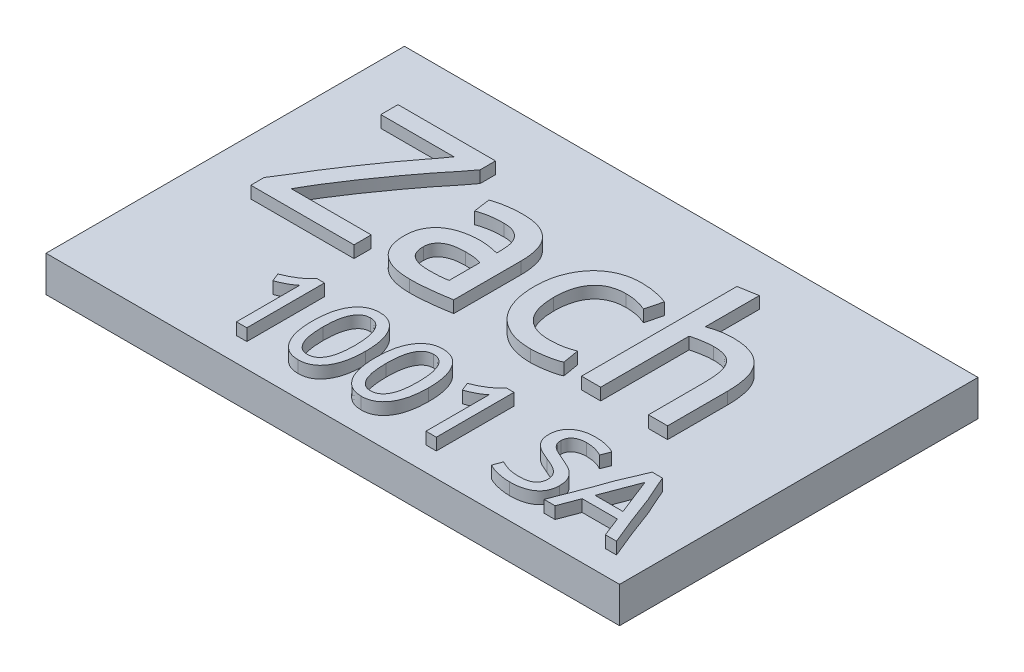
from build123d import *

# Parameters (mm, degrees)
SKETCH1_W           = 48
SKETCH1_H           = 30
BOSS_EXTRUDE1_DEPTH = 3
BOSS_EXTRUDE2_DEPTH = 1
BOSS_EXTRUDE3_DEPTH = 1
SKETCH4_W           = 46
SKETCH4_H           = 14
CUT_EXTRUDE1_DEPTH  = 1


with BuildPart() as part:
    # Sketch1 → Boss-Extrude1 (new body)
    with BuildSketch(Plane(origin=(0, 0, 0), x_dir=(1, 0, 0), z_dir=(0, 1, 0))):
        Rectangle(SKETCH1_W, SKETCH1_H)
    extrude(amount=BOSS_EXTRUDE1_DEPTH)

    # Sketch2 → Boss-Extrude2 (add)
    # profile 1 of 6: a face of its own
    with BuildSketch(Plane(origin=(0, 3, 0), x_dir=(1, 0, 0), z_dir=(0, 1, 0))):
        with BuildLine():
            add(Edge.make_bspline(
                [(20.8190625, -13), (20.761807352, -12.854173323), (20.650636551, -12.571025533), (20.48598857, -12.155157713), (20.327823205, -11.751782411), (20.222834076, -11.48601949), (20.170416667, -11.353333333)],
                knots=[0, 0, 0, 0, 1.062237098, 2.062517583, 3.032682611, 4, 4, 4, 4], degree=3))
            Line((20.170416667, -11.353333333), (17.2278125, -11.353333333))
            Line((17.2278125, -11.353333333), (16.60625, -13))
            Line((16.60625, -13), (15.68, -13))
            add(Edge.make_bspline(
                [(15.68, -13), (15.744821902, -12.833818932), (15.872240995, -12.507160193), (16.06273731, -12.027772572), (16.241862799, -11.564634011), (16.417870298, -11.119989175), (16.586201878, -10.687924801), (16.741576351, -10.264600062), (16.892947004, -9.851356741), (17.028411342, -9.443833001), (17.165283229, -9.046661754), (17.310557286, -8.662073666), (17.461536484, -8.289215602), (17.675399086, -7.810041385), (17.941578878, -7.21894363), (18.134037627, -6.73903085), (18.229895833, -6.5)],
                knots=[0, 0, 0, 0, 1.072638977, 2.108464584, 3.101975064, 4.058669342, 4.98415727, 5.890223607, 6.770302648, 7.630393209, 8.472516756, 9.296294923, 10.102279314, 10.891058867, 12.451525209, 14, 14, 14, 14], degree=3))
            Line((18.229895833, -6.5), (19.095208333, -6.5))
            add(Edge.make_bspline(
                [(19.095208333, -6.5), (19.196442907, -6.744035481), (19.397845932, -7.229536452), (19.674611509, -7.825573535), (19.895467203, -8.304015687), (20.054526587, -8.674142624), (20.204248223, -9.057069953), (20.346405395, -9.452230923), (20.49015853, -9.856553347), (20.643747325, -10.268664226), (20.805455931, -10.68925814), (20.979498189, -11.118901386), (21.160161008, -11.562838639), (21.348343181, -12.024629845), (21.545003917, -12.505684979), (21.678527564, -12.832977672), (21.746666667, -13)],
                knots=[0, 0, 0, 0, 1.580032327, 3.143424997, 3.929926182, 4.731809389, 5.552523687, 6.388666205, 7.243499056, 8.11910645, 9.019081739, 9.938542983, 10.891608821, 11.885790057, 12.921087233, 14, 14, 14, 14], degree=3))
            Line((21.746666667, -13), (20.8190625, -13))
        make_face()
        with BuildLine():
            add(Edge.make_bspline(
                [(19.863020833, -10.573333333), (19.76115474, -10.313726537), (19.559137918, -9.798884569), (19.256059293, -9.03411697), (18.962235431, -8.28183259), (18.766715196, -7.785509191), (18.67, -7.54)],
                knots=[0, 0, 0, 0, 1.02669444, 2.036099954, 3.028545676, 4, 4, 4, 4], degree=3))
            add(Edge.make_bspline(
                [(18.67, -7.54), (18.577162775, -7.786966003), (18.389368531, -8.286537098), (18.102851975, -9.04033945), (17.813146681, -9.804233136), (17.620830154, -10.316439453), (17.524375, -10.573333333)],
                knots=[0, 0, 0, 0, 0.976437122, 1.975169686, 2.984458995, 4, 4, 4, 4], degree=3))
            Line((17.524375, -10.573333333), (19.863020833, -10.573333333))
        make_face(mode=Mode.SUBTRACT)
    # profile 2 of 6: a face of its own
    with BuildSketch(Plane(origin=(0, 3, 0), x_dir=(1, 0, 0), z_dir=(0, 1, 0))):
        with BuildLine():
            add(Edge.make_bspline(
                [(12.9784375, -12.393333333), (13.034890788, -12.392641957), (13.144775376, -12.391296214), (13.303787709, -12.378407742), (13.452467748, -12.360828973), (13.589272929, -12.331587259), (13.715952999, -12.297183299), (13.831556415, -12.253711697), (13.936502897, -12.202908563), (14.029115933, -12.142046997), (14.112840376, -12.07652795), (14.18413179, -12.000255841), (14.24530268, -11.916880408), (14.293686564, -11.824610977), (14.334479377, -11.726303303), (14.360422604, -11.618482644), (14.377123193, -11.50327075), (14.379025759, -11.4238128), (14.38, -11.383125)],
                knots=[0, 0, 0, 0, 1.377492973, 2.681247697, 3.891940251, 5.028431159, 6.092277143, 7.092864452, 8.038832474, 8.931122951, 9.793110516, 10.626971684, 11.47095992, 12.308886602, 13.164018022, 14.061800404, 15.007511787, 16, 16, 16, 16], degree=3))
            add(Edge.make_bspline(
                [(14.38, -11.383125), (14.378248526, -11.332966636), (14.374870284, -11.236221197), (14.354425681, -11.096399296), (14.313900234, -10.969486637), (14.261092813, -10.85275502), (14.193202311, -10.746688112), (14.116136108, -10.647840403), (14.028563113, -10.555656857), (13.894216999, -10.443639184), (13.705362657, -10.315091342), (13.45099212, -10.185303397), (13.176042084, -10.062678665), (12.986243636, -9.982163236), (12.8890625, -9.9409375)],
                knots=[0, 0, 0, 0, 0.811365835, 1.5649622, 2.276000999, 2.95859887, 3.630934483, 4.306944628, 4.983230544, 5.682292857, 7.131827656, 8.666343326, 10.293091724, 12, 12, 12, 12], degree=3))
            add(Edge.make_bspline(
                [(12.8890625, -9.9409375), (12.776371075, -9.895617212), (12.553287138, -9.805901174), (12.281123213, -9.684204557), (12.074607748, -9.578150145), (11.931874953, -9.490865041), (11.79908957, -9.397592238), (11.675778846, -9.297741743), (11.566378226, -9.186876267), (11.465685139, -9.069401214), (11.381156441, -8.939070663), (11.305121612, -8.800751564), (11.244611606, -8.648765182), (11.203566488, -8.48156441), (11.177232941, -8.300074076), (11.17466016, -8.173847285), (11.173333333, -8.10875)],
                knots=[0, 0, 0, 0, 1.881476714, 3.724571196, 4.615906794, 5.475721414, 6.3137665, 7.128471691, 7.929438621, 8.723539643, 9.520590439, 10.330872839, 11.165761655, 12.045919756, 12.992247868, 14, 14, 14, 14], degree=3))
            add(Edge.make_bspline(
                [(11.173333333, -8.10875), (11.175296653, -8.040513417), (11.179120728, -7.907604914), (11.204736213, -7.713684568), (11.249268627, -7.530972405), (11.313036278, -7.36034556), (11.3936935, -7.201210227), (11.491906996, -7.053584871), (11.608980622, -6.917797268), (11.744017172, -6.794465042), (11.89351955, -6.683703394), (12.058266257, -6.588250847), (12.23564201, -6.507295521), (12.42687379, -6.440496407), (12.631398234, -6.389562728), (12.849699214, -6.353675915), (13.080814717, -6.329578615), (13.23972774, -6.327652326), (13.321041667, -6.326666667)],
                knots=[0, 0, 0, 0, 1.036936748, 2.019704159, 2.966376421, 3.888880766, 4.781625726, 5.672022014, 6.576782996, 7.499210823, 8.445883085, 9.398871932, 10.387273209, 11.404763735, 12.472884254, 13.585964168, 14.764766231, 16, 16, 16, 16], degree=3))
            add(Edge.make_bspline(
                [(13.321041667, -6.326666667), (13.415872694, -6.328321163), (13.601307689, -6.331556407), (13.872906767, -6.354055446), (14.13064179, -6.395020285), (14.371966133, -6.449877568), (14.590099232, -6.514546426), (14.781523377, -6.579430047), (14.940702473, -6.649639935), (15.031813281, -6.70498642), (15.073333333, -6.730208333)],
                knots=[0, 0, 0, 0, 1.25147498, 2.447165896, 3.593012675, 4.692731984, 5.710660103, 6.594242178, 7.359382933, 8, 8, 8, 8], degree=3))
            Line((15.073333333, -6.730208333), (14.783541667, -7.4628125))
            add(Edge.make_bspline(
                [(14.783541667, -7.4628125), (14.748238816, -7.441822444), (14.671930811, -7.396451906), (14.540062023, -7.338272217), (14.386036961, -7.278918404), (14.210112999, -7.221263989), (14.015452023, -7.168826589), (13.802756896, -7.133716188), (13.575285344, -7.109453982), (13.418160132, -7.107613775), (13.337291667, -7.106666667)],
                knots=[0, 0, 0, 0, 0.653649503, 1.412879949, 2.2914092, 3.282670824, 4.360349048, 5.49858183, 6.712581845, 8, 8, 8, 8], degree=3))
            add(Edge.make_bspline(
                [(13.337291667, -7.106666667), (13.255370816, -7.108876614), (13.095719752, -7.113183461), (12.867527968, -7.157555382), (12.659948618, -7.225871558), (12.508834056, -7.31151324), (12.40315263, -7.392023819), (12.333654413, -7.460320942), (12.272382729, -7.536735215), (12.219601693, -7.620475922), (12.176512947, -7.711483563), (12.149195081, -7.811467761), (12.128727876, -7.917881987), (12.127364424, -7.992183795), (12.126666667, -8.030208333)],
                knots=[0, 0, 0, 0, 1.719475256, 3.350991228, 4.86583626, 6.292971001, 6.9759855, 7.653444794, 8.334876713, 9.02964567, 9.729896761, 10.441301586, 11.202323736, 12, 12, 12, 12], degree=3))
            add(Edge.make_bspline(
                [(12.126666667, -8.030208333), (12.128079214, -8.072698766), (12.130782094, -8.154003296), (12.148231543, -8.27148988), (12.178846359, -8.37824326), (12.223034174, -8.475269892), (12.27988536, -8.562389277), (12.345652073, -8.644018462), (12.41969957, -8.722037015), (12.537368595, -8.816698814), (12.704497396, -8.926923164), (12.930820693, -9.044813963), (13.184143271, -9.156072561), (13.362339042, -9.226954473), (13.455104167, -9.263854167)],
                knots=[0, 0, 0, 0, 0.785038728, 1.502154768, 2.188344236, 2.830229253, 3.464100274, 4.104900842, 4.765475595, 5.446731494, 6.890051486, 8.456936281, 10.155552478, 12, 12, 12, 12], degree=3))
            add(Edge.make_bspline(
                [(13.455104167, -9.263854167), (13.585963713, -9.319348331), (13.839324423, -9.426792084), (14.145056131, -9.571682858), (14.372791253, -9.691644534), (14.529111907, -9.78897736), (14.672765142, -9.89631002), (14.805066683, -10.011685812), (14.925038375, -10.136579162), (15.031686197, -10.272565604), (15.122396279, -10.420955928), (15.198886975, -10.580999659), (15.26126959, -10.755251165), (15.303226913, -10.946780188), (15.329488379, -11.155342566), (15.332020238, -11.299984492), (15.333333333, -11.375)],
                knots=[0, 0, 0, 0, 1.95273218, 3.780737635, 4.64641346, 5.487847706, 6.307705496, 7.107546074, 7.897078186, 8.683584325, 9.477052339, 10.281471897, 11.117058081, 12.013722982, 12.969858994, 14, 14, 14, 14], degree=3))
            add(Edge.make_bspline(
                [(15.333333333, -11.375), (15.33158505, -11.445061313), (15.328174744, -11.581727137), (15.299515767, -11.780745878), (15.251008199, -11.967086969), (15.182411895, -12.141004912), (15.095999691, -12.302981034), (14.988955258, -12.451792185), (14.86337477, -12.588639965), (14.717816947, -12.710920927), (14.556586773, -12.821744326), (14.376821829, -12.914237624), (14.183674008, -12.996442477), (13.972760658, -13.060526445), (13.747551065, -13.112427894), (13.505509101, -13.14587768), (13.248878356, -13.170605479), (13.071940899, -13.172408247), (12.981145833, -13.173333333)],
                knots=[0, 0, 0, 0, 1.002359664, 1.955263247, 2.87036426, 3.752111736, 4.625011069, 5.490901748, 6.36873565, 7.276165365, 8.206127549, 9.162637605, 10.164476677, 11.20656157, 12.313001129, 13.468736406, 14.701087669, 16, 16, 16, 16], degree=3))
            add(Edge.make_bspline(
                [(12.981145833, -13.173333333), (12.859615517, -13.170782527), (12.625856971, -13.165876157), (12.291353088, -13.127481923), (11.990287499, -13.068993208), (11.721990894, -13.006282049), (11.489490545, -12.931916068), (11.31801144, -12.867563155), (11.199117617, -12.815368344), (11.124781107, -12.777519572), (11.058422325, -12.746350722), (11.018414486, -12.724382287), (11, -12.714270833)],
                knots=[0, 0, 0, 0, 1.77521498, 3.414552703, 4.9110395, 6.254623107, 7.437219514, 8.474610623, 8.929266385, 9.333326447, 9.693148859, 10, 10, 10, 10], degree=3))
            Line((11, -12.714270833), (11.2721875, -11.9721875))
            add(Edge.make_bspline(
                [(11.2721875, -11.9721875), (11.312134676, -11.993411804), (11.399733577, -12.039953912), (11.548125636, -12.105114694), (11.723174801, -12.175543605), (11.924249737, -12.249092972), (12.152275178, -12.315344041), (12.406537443, -12.359249921), (12.684343637, -12.388689472), (12.877692122, -12.391742523), (12.9784375, -12.393333333)],
                knots=[0, 0, 0, 0, 0.610817719, 1.339442905, 2.18743935, 3.159432638, 4.230564173, 5.389377797, 6.639719769, 8, 8, 8, 8], degree=3))
        make_face()
    # profile 3 of 6: a face of its own
    with BuildSketch(Plane(origin=(0, 3, 0), x_dir=(1, 0, 0), z_dir=(0, 1, 0))):
        with BuildLine():
            add(Edge.make_bspline(
                [(4.066666667, -7.8), (4.15646084, -7.765344145), (4.336718495, -7.695774118), (4.600530267, -7.572735658), (4.861018403, -7.436817381), (5.118721605, -7.288772888), (5.369764289, -7.123325366), (5.608563437, -6.934551399), (5.838291675, -6.728043998), (5.980268921, -6.576454173), (6.051875, -6.5)],
                knots=[0, 0, 0, 0, 0.963670418, 1.934523835, 2.913123699, 3.905574515, 4.909835641, 5.920849986, 6.951382817, 8, 8, 8, 8], degree=3))
            Line((6.051875, -6.5), (6.666666667, -6.5))
            Line((6.666666667, -6.5), (6.666666667, -13))
            Line((6.666666667, -13), (5.8, -13))
            Line((5.8, -13), (5.8, -7.707916667))
            add(Edge.make_bspline(
                [(5.8, -7.707916667), (5.758082094, -7.743777446), (5.668451805, -7.820456181), (5.516041511, -7.927248078), (5.345494294, -8.036895325), (5.158387958, -8.140650289), (4.960010516, -8.241235824), (4.754842733, -8.33535451), (4.54889016, -8.422886001), (4.409577067, -8.470222839), (4.3415625, -8.493333333)],
                knots=[0, 0, 0, 0, 0.794248259, 1.698288552, 2.677753972, 3.71416365, 4.778489051, 5.881154201, 6.96555036, 8, 8, 8, 8], degree=3))
            Line((4.3415625, -8.493333333), (4.066666667, -7.8))
        make_face()
    # profile 4 of 6: a face of its own
    with BuildSketch(Plane(origin=(0, 3, 0), x_dir=(1, 0, 0), z_dir=(0, 1, 0))):
        with BuildLine():
            add(Edge.make_bspline(
                [(-1.653333333, -9.75), (-1.651477681, -9.616797053), (-1.647869287, -9.35777825), (-1.621058849, -8.981108418), (-1.575195832, -8.6284587), (-1.51248706, -8.299235686), (-1.429671093, -7.9938303), (-1.330573803, -7.71092255), (-1.210766405, -7.452291045), (-1.074498141, -7.217389514), (-0.921831657, -7.007832074), (-0.752766933, -6.825850927), (-0.568883903, -6.671752962), (-0.371368451, -6.544383035), (-0.159473749, -6.445870278), (0.066608553, -6.377074607), (0.306727272, -6.333552513), (0.472064794, -6.328997454), (0.556666667, -6.326666667)],
                knots=[0, 0, 0, 0, 1.398128919, 2.718721218, 3.961112149, 5.129153744, 6.233707261, 7.279741098, 8.271847051, 9.221002949, 10.126027053, 10.987590439, 11.821735889, 12.637925415, 13.447694729, 14.26597198, 15.11271189, 16, 16, 16, 16], degree=3))
            add(Edge.make_bspline(
                [(0.556666667, -6.326666667), (0.641268912, -6.328997009), (0.806607164, -6.333551198), (1.046720661, -6.377079518), (1.272821907, -6.445852605), (1.484646829, -6.544448552), (1.682134515, -6.671316522), (1.864776623, -6.826348532), (2.033875717, -7.007759988), (2.186434543, -7.217418899), (2.322854247, -7.452248064), (2.442199539, -7.711211686), (2.543429313, -7.993516369), (2.625685228, -8.299284226), (2.688568769, -8.628444478), (2.734380607, -8.981112575), (2.761205791, -9.357777111), (2.764812091, -9.616796666), (2.766666667, -9.75)],
                knots=[0, 0, 0, 0, 0.887400701, 1.734248057, 2.552629143, 3.362501211, 4.178794306, 5.00941744, 5.871090153, 6.776229099, 7.725505439, 8.717737283, 9.76550172, 10.870195399, 12.038385211, 13.280933793, 14.601693668, 16, 16, 16, 16], degree=3))
            add(Edge.make_bspline(
                [(2.766666667, -9.75), (2.764813234, -9.883203641), (2.761209155, -10.142223794), (2.734368324, -10.518884121), (2.688610791, -10.871566826), (2.625459742, -11.201105432), (2.543683527, -11.507456016), (2.442172757, -11.790134711), (2.322862383, -12.049110312), (2.186427442, -12.283926289), (2.033895087, -12.493623945), (1.864710431, -12.674902246), (1.682555243, -12.830247924), (1.484208827, -12.95531447), (1.272880566, -13.05423917), (1.046704364, -13.122894983), (0.806611528, -13.166455629), (0.641270389, -13.171005302), (0.556666667, -13.173333333)],
                knots=[0, 0, 0, 0, 1.398129316, 2.718721992, 3.961113276, 5.129155203, 6.238282735, 7.285914532, 8.278020767, 9.227176935, 10.132201297, 10.993764928, 11.82428291, 12.637924458, 13.447694002, 14.265971487, 15.112711637, 16, 16, 16, 16], degree=3))
            add(Edge.make_bspline(
                [(0.556666667, -13.173333333), (0.472063318, -13.171004856), (0.306722911, -13.16645431), (0.066624842, -13.122899908), (-0.159532375, -13.054221445), (-0.370930499, -12.955380093), (-0.56930646, -12.829814083), (-0.752700706, -12.675399766), (-0.921851006, -12.49355183), (-1.074491034, -12.283955678), (-1.210774592, -12.049067348), (-1.330546827, -11.790423777), (-1.429922962, -11.50714126), (-1.512261779, -11.201154048), (-1.575237861, -10.871552606), (-1.621046565, -10.518888278), (-1.647872652, -10.142222655), (-1.651478824, -9.883203255), (-1.653333333, -9.75)],
                knots=[0, 0, 0, 0, 0.8871758, 1.733808532, 2.551982208, 3.361649024, 4.175187352, 5.009227218, 5.87068155, 6.775591099, 7.724626855, 8.71660723, 9.762508663, 10.871495489, 12.039389237, 13.281622909, 14.602048052, 16, 16, 16, 16], degree=3))
        make_face()
        with BuildLine():
            add(Edge.make_bspline(
                [(1.9, -9.75), (1.89923518, -9.661513773), (1.897724312, -9.486713055), (1.885282506, -9.228370447), (1.865048378, -8.977248196), (1.837063844, -8.734572549), (1.800530714, -8.50225766), (1.750136352, -8.283908888), (1.689777492, -8.080531644), (1.618201679, -7.892704283), (1.535168151, -7.721168963), (1.43684909, -7.568075617), (1.325602362, -7.43282236), (1.200530362, -7.316719268), (1.062038608, -7.221343324), (0.90683556, -7.15390294), (0.736502135, -7.114173893), (0.617820087, -7.109219514), (0.556666667, -7.106666667)],
                knots=[0, 0, 0, 0, 1.288857495, 2.546082284, 3.766455244, 4.95798845, 6.10378117, 7.189955992, 8.219636452, 9.191607874, 10.114926122, 10.990369042, 11.835586965, 12.659147628, 13.468838365, 14.272634517, 15.109938625, 16, 16, 16, 16], degree=3))
            add(Edge.make_bspline(
                [(0.556666667, -7.106666667), (0.495506477, -7.109201771), (0.376811291, -7.114121713), (0.206165263, -7.154189282), (0.050278357, -7.221016501), (-0.088494078, -7.316320119), (-0.212258152, -7.43331126), (-0.323578185, -7.568010002), (-0.421816839, -7.721187858), (-0.50487355, -7.892698813), (-0.576442642, -8.080533238), (-0.636803459, -8.283908425), (-0.687197253, -8.502257794), (-0.723730547, -8.734572511), (-0.751715034, -8.977248206), (-0.771949175, -9.228370444), (-0.784390978, -9.486713056), (-0.785901847, -9.661513773), (-0.786666667, -9.75)],
                knots=[0, 0, 0, 0, 0.889994021, 1.727234767, 2.536997691, 3.346627155, 4.165308675, 5.010462637, 5.885839309, 6.809087686, 7.780985557, 8.810588097, 9.896680724, 11.042386738, 12.233829776, 13.454110387, 14.711240037, 16, 16, 16, 16], degree=3))
            add(Edge.make_bspline(
                [(-0.786666667, -9.75), (-0.785900546, -9.838486104), (-0.784387107, -10.013286579), (-0.771964036, -10.271630954), (-0.75162548, -10.523193748), (-0.723812871, -10.76633585), (-0.687379237, -10.998688928), (-0.636587402, -11.21649242), (-0.576465043, -11.419471977), (-0.50486801, -11.607299897), (-0.421818209, -11.778812461), (-0.32357784, -11.931989918), (-0.21225824, -12.06668876), (-0.088494055, -12.183679875), (0.050278351, -12.278983501), (0.206165265, -12.345810718), (0.376811291, -12.385878287), (0.495506477, -12.390798229), (0.556666667, -12.393333333)],
                knots=[0, 0, 0, 0, 1.288749976, 2.545869886, 3.76614104, 4.964105282, 6.109802418, 7.189480174, 8.219074737, 9.190965076, 10.114206299, 10.989576188, 11.834723601, 12.653398777, 13.463021968, 14.272778617, 15.110012875, 16, 16, 16, 16], degree=3))
            add(Edge.make_bspline(
                [(0.556666667, -12.393333333), (0.617820087, -12.390780486), (0.736502136, -12.385826107), (0.906835558, -12.346097059), (1.062038614, -12.278656677), (1.200530339, -12.183280726), (1.32560245, -12.06717766), (1.436848744, -11.931924303), (1.535169521, -11.778831356), (1.618196139, -11.607294427), (1.689799892, -11.419473571), (1.749920298, -11.21649196), (1.800712698, -10.998689062), (1.837146168, -10.766335812), (1.864958824, -10.523193759), (1.885297367, -10.271630951), (1.897720441, -10.01328658), (1.899233879, -9.838486105), (1.9, -9.75)],
                knots=[0, 0, 0, 0, 0.890054478, 1.727352097, 2.53114202, 3.340826482, 4.164380764, 5.009592136, 5.885028272, 6.808339365, 7.780303255, 8.809975736, 9.8897352, 11.035519041, 12.233573943, 13.453937447, 14.711152493, 16, 16, 16, 16], degree=3))
        make_face(mode=Mode.SUBTRACT)
    # profile 5 of 6: a face of its own
    with BuildSketch(Plane(origin=(0, 3, 0), x_dir=(1, 0, 0), z_dir=(0, 1, 0))):
        with BuildLine():
            add(Edge.make_bspline(
                [(-6.94, -9.75), (-6.938144348, -9.616797053), (-6.934535954, -9.35777825), (-6.907725516, -8.981108418), (-6.861862499, -8.6284587), (-6.799153727, -8.299235686), (-6.71633776, -7.9938303), (-6.61724047, -7.71092255), (-6.497433071, -7.452291045), (-6.361164807, -7.217389514), (-6.208498324, -7.007832074), (-6.039433599, -6.825850927), (-5.85555057, -6.671752962), (-5.658035117, -6.544383035), (-5.446140416, -6.445870278), (-5.220058113, -6.377074607), (-4.979939394, -6.333552513), (-4.814601872, -6.328997454), (-4.73, -6.326666667)],
                knots=[0, 0, 0, 0, 1.398128919, 2.718721218, 3.961112149, 5.129153744, 6.233707261, 7.279741098, 8.271847051, 9.221002949, 10.126027053, 10.987590439, 11.821735889, 12.637925415, 13.447694729, 14.26597198, 15.11271189, 16, 16, 16, 16], degree=3))
            add(Edge.make_bspline(
                [(-4.73, -6.326666667), (-4.645397754, -6.328997009), (-4.480059503, -6.333551198), (-4.239946005, -6.377079518), (-4.01384476, -6.445852605), (-3.802019837, -6.544448552), (-3.604532152, -6.671316522), (-3.421890044, -6.826348532), (-3.25279095, -7.007759988), (-3.100232124, -7.217418899), (-2.963812419, -7.452248064), (-2.844467128, -7.711211686), (-2.743237354, -7.993516369), (-2.660981439, -8.299284226), (-2.598097898, -8.628444478), (-2.55228606, -8.981112575), (-2.525460876, -9.357777111), (-2.521854575, -9.616796666), (-2.52, -9.75)],
                knots=[0, 0, 0, 0, 0.887400701, 1.734248057, 2.552629143, 3.362501211, 4.178794306, 5.00941744, 5.871090153, 6.776229099, 7.725505439, 8.717737283, 9.76550172, 10.870195399, 12.038385211, 13.280933793, 14.601693668, 16, 16, 16, 16], degree=3))
            add(Edge.make_bspline(
                [(-2.52, -9.75), (-2.521853433, -9.883203641), (-2.525457511, -10.142223794), (-2.552298343, -10.518884121), (-2.598055876, -10.871566826), (-2.661206925, -11.201105432), (-2.742983139, -11.507456016), (-2.84449391, -11.790134711), (-2.963804283, -12.049110312), (-3.100239224, -12.283926289), (-3.25277158, -12.493623945), (-3.421956235, -12.674902246), (-3.604111424, -12.830247924), (-3.80245784, -12.95531447), (-4.013786101, -13.05423917), (-4.239962303, -13.122894983), (-4.480055139, -13.166455629), (-4.645396277, -13.171005302), (-4.73, -13.173333333)],
                knots=[0, 0, 0, 0, 1.398129316, 2.718721992, 3.961113276, 5.129155203, 6.238282735, 7.285914532, 8.278020767, 9.227176935, 10.132201297, 10.993764928, 11.82428291, 12.637924458, 13.447694002, 14.265971487, 15.112711637, 16, 16, 16, 16], degree=3))
            add(Edge.make_bspline(
                [(-4.73, -13.173333333), (-4.814603349, -13.171004856), (-4.979943756, -13.16645431), (-5.220041825, -13.122899908), (-5.446199042, -13.054221445), (-5.657597166, -12.955380093), (-5.855973126, -12.829814083), (-6.039367373, -12.675399766), (-6.208517673, -12.49355183), (-6.3611577, -12.283955678), (-6.497441258, -12.049067348), (-6.617213493, -11.790423777), (-6.716589628, -11.50714126), (-6.798928445, -11.201154048), (-6.861904527, -10.871552606), (-6.907713231, -10.518888278), (-6.934539319, -10.142222655), (-6.938145491, -9.883203255), (-6.94, -9.75)],
                knots=[0, 0, 0, 0, 0.8871758, 1.733808532, 2.551982208, 3.361649024, 4.175187352, 5.009227218, 5.87068155, 6.775591099, 7.724626855, 8.71660723, 9.762508663, 10.871495489, 12.039389237, 13.281622909, 14.602048052, 16, 16, 16, 16], degree=3))
        make_face()
        with BuildLine():
            add(Edge.make_bspline(
                [(-3.386666667, -9.75), (-3.387431486, -9.661513773), (-3.388942354, -9.486713055), (-3.401384161, -9.228370447), (-3.421618289, -8.977248196), (-3.449602823, -8.734572549), (-3.486135952, -8.50225766), (-3.536530315, -8.283908888), (-3.596889175, -8.080531644), (-3.668464987, -7.892704283), (-3.751498516, -7.721168963), (-3.849817577, -7.568075617), (-3.961064305, -7.43282236), (-4.086136305, -7.316719268), (-4.224628058, -7.221343324), (-4.379831107, -7.15390294), (-4.550164531, -7.114173893), (-4.66884658, -7.109219514), (-4.73, -7.106666667)],
                knots=[0, 0, 0, 0, 1.288857495, 2.546082284, 3.766455244, 4.95798845, 6.10378117, 7.189955992, 8.219636452, 9.191607874, 10.114926122, 10.990369042, 11.835586965, 12.659147628, 13.468838365, 14.272634517, 15.109938625, 16, 16, 16, 16], degree=3))
            add(Edge.make_bspline(
                [(-4.73, -7.106666667), (-4.79116019, -7.109201771), (-4.909855375, -7.114121713), (-5.080501403, -7.154189282), (-5.23638831, -7.221016501), (-5.375160744, -7.316320119), (-5.498924819, -7.43331126), (-5.610244852, -7.568010002), (-5.708483506, -7.721187858), (-5.791540216, -7.892698813), (-5.863109309, -8.080533238), (-5.923470126, -8.283908425), (-5.97386392, -8.502257794), (-6.010397214, -8.734572511), (-6.038381701, -8.977248206), (-6.058615842, -9.228370444), (-6.071057645, -9.486713056), (-6.072568513, -9.661513773), (-6.073333333, -9.75)],
                knots=[0, 0, 0, 0, 0.889994021, 1.727234767, 2.536997691, 3.346627155, 4.165308675, 5.010462637, 5.885839309, 6.809087686, 7.780985557, 8.810588097, 9.896680724, 11.042386738, 12.233829776, 13.454110387, 14.711240037, 16, 16, 16, 16], degree=3))
            add(Edge.make_bspline(
                [(-6.073333333, -9.75), (-6.072567212, -9.838486104), (-6.071053773, -10.013286579), (-6.058630703, -10.271630954), (-6.038292147, -10.523193748), (-6.010479538, -10.76633585), (-5.974045904, -10.998688928), (-5.923254069, -11.21649242), (-5.863131709, -11.419471977), (-5.791534677, -11.607299897), (-5.708484876, -11.778812461), (-5.610244506, -11.931989918), (-5.498924907, -12.06668876), (-5.375160721, -12.183679875), (-5.236388316, -12.278983501), (-5.080501402, -12.345810718), (-4.909855376, -12.385878287), (-4.79116019, -12.390798229), (-4.73, -12.393333333)],
                knots=[0, 0, 0, 0, 1.288749976, 2.545869886, 3.76614104, 4.964105282, 6.109802418, 7.189480174, 8.219074737, 9.190965076, 10.114206299, 10.989576188, 11.834723601, 12.653398777, 13.463021968, 14.272778617, 15.110012875, 16, 16, 16, 16], degree=3))
            add(Edge.make_bspline(
                [(-4.73, -12.393333333), (-4.66884658, -12.390780486), (-4.550164531, -12.385826107), (-4.379831109, -12.346097059), (-4.224628052, -12.278656677), (-4.086136328, -12.183280726), (-3.961064216, -12.06717766), (-3.849817922, -11.931924303), (-3.751497146, -11.778831356), (-3.668470527, -11.607294427), (-3.596866774, -11.419473571), (-3.536746369, -11.21649196), (-3.485953968, -10.998689062), (-3.449520499, -10.766335812), (-3.421707843, -10.523193759), (-3.4013693, -10.271630951), (-3.388946226, -10.01328658), (-3.387432787, -9.838486105), (-3.386666667, -9.75)],
                knots=[0, 0, 0, 0, 0.890054478, 1.727352097, 2.53114202, 3.340826482, 4.164380764, 5.009592136, 5.885028272, 6.808339365, 7.780303255, 8.809975736, 9.8897352, 11.035519041, 12.233573943, 13.453937447, 14.711152493, 16, 16, 16, 16], degree=3))
        make_face(mode=Mode.SUBTRACT)
    # profile 6 of 6: a face of its own
    with BuildSketch(Plane(origin=(0, 3, 0), x_dir=(1, 0, 0), z_dir=(0, 1, 0))):
        with BuildLine():
            add(Edge.make_bspline(
                [(-11.793333333, -7.8), (-11.70353916, -7.765344145), (-11.523281505, -7.695774118), (-11.259469733, -7.572735658), (-10.998981597, -7.436817381), (-10.741278395, -7.288772888), (-10.490235711, -7.123325366), (-10.251436563, -6.934551399), (-10.021708325, -6.728043998), (-9.879731079, -6.576454173), (-9.808125, -6.5)],
                knots=[0, 0, 0, 0, 0.963670418, 1.934523835, 2.913123699, 3.905574515, 4.909835641, 5.920849986, 6.951382817, 8, 8, 8, 8], degree=3))
            Line((-9.808125, -6.5), (-9.193333333, -6.5))
            Line((-9.193333333, -6.5), (-9.193333333, -13))
            Line((-9.193333333, -13), (-10.06, -13))
            Line((-10.06, -13), (-10.06, -7.707916667))
            add(Edge.make_bspline(
                [(-10.06, -7.707916667), (-10.101917906, -7.743777446), (-10.191548195, -7.820456181), (-10.343958489, -7.927248078), (-10.514505706, -8.036895325), (-10.701612042, -8.140650289), (-10.899989484, -8.241235824), (-11.105157267, -8.33535451), (-11.31110984, -8.422886001), (-11.450422933, -8.470222839), (-11.5184375, -8.493333333)],
                knots=[0, 0, 0, 0, 0.794248259, 1.698288552, 2.677753972, 3.71416365, 4.778489051, 5.881154201, 6.96555036, 8, 8, 8, 8], degree=3))
            Line((-11.5184375, -8.493333333), (-11.793333333, -7.8))
        make_face()
    extrude(amount=BOSS_EXTRUDE2_DEPTH)

    # Sketch3 → Boss-Extrude3 (add)
    # profile 1 of 4: a face of its own
    with BuildSketch(Plane(origin=(0, 3, 0), x_dir=(1, 0, 0), z_dir=(0, 1, 0))):
        with BuildLine():
            add(Edge.make_bspline(
                [(-10.88, 8.22), (-10.947132537, 8.126396852), (-11.085370219, 7.933651534), (-11.304821217, 7.642948581), (-11.540026339, 7.340833976), (-11.796330943, 7.033735096), (-12.062012786, 6.710132721), (-12.336454193, 6.371826666), (-12.617479203, 6.014617327), (-13.007495596, 5.510672938), (-13.504885751, 4.846340646), (-14.111820057, 4.022674794), (-14.718947555, 3.171455227), (-15.318542055, 2.309983192), (-15.894248048, 1.44464072), (-16.4402171, 0.589203322), (-16.946912409, -0.242190119), (-17.25730241, -0.79331224), (-17.4075, -1.06)],
                knots=[0, 0, 0, 0, 0.486714395, 1.002230399, 1.538991894, 2.104374088, 2.692301471, 3.308233795, 3.945069881, 4.612777537, 6.000868073, 7.451704174, 8.935973151, 10.418746027, 11.886617637, 13.327441272, 14.706749966, 16, 16, 16, 16], degree=3))
            Line((-17.4075, -1.06), (-10.72, -1.06))
            Line((-10.72, -1.06), (-10.72, -2.5))
            Line((-10.72, -2.5), (-19.36, -2.5))
            Line((-19.36, -2.5), (-19.36, -1.38))
            add(Edge.make_bspline(
                [(-19.36, -1.38), (-19.288896906, -1.273511515), (-19.141804956, -1.053217316), (-18.918427671, -0.707048567), (-18.686984265, -0.333497922), (-18.364847062, 0.207575076), (-17.942616477, 0.911034719), (-17.402129423, 1.767087587), (-16.834038533, 2.635449431), (-16.247319424, 3.508018786), (-15.653275846, 4.367976851), (-15.060139135, 5.198279008), (-14.478598859, 5.984401093), (-14.000324945, 6.606345727), (-13.630218286, 7.075318548), (-13.378691111, 7.414863249), (-13.139349592, 7.738821169), (-12.990293472, 7.954614535), (-12.9175, 8.06)],
                knots=[0, 0, 0, 0, 0.537401585, 1.111730074, 1.729010068, 2.381613847, 3.754607445, 5.172311355, 6.630340788, 8.109659246, 9.585301653, 11.016864208, 12.392114501, 13.689086042, 14.30964694, 14.899329146, 15.462473235, 16, 16, 16, 16], degree=3))
            Line((-12.9175, 8.06), (-19.04, 8.06))
            Line((-19.04, 8.06), (-19.04, 9.5))
            Line((-19.04, 9.5), (-10.88, 9.5))
            Line((-10.88, 9.5), (-10.88, 8.22))
        make_face()
    # profile 2 of 4: a face of its own
    with BuildSketch(Plane(origin=(0, 3, 0), x_dir=(1, 0, 0), z_dir=(0, 1, 0))):
        with BuildLine():
            add(Edge.make_bspline(
                [(-5.8425, 6.78), (-5.69485997, 6.777572012), (-5.411243674, 6.77290785), (-5.003637003, 6.725020727), (-4.632389373, 6.646437837), (-4.296577397, 6.535651275), (-3.993368609, 6.398001203), (-3.722036594, 6.231813308), (-3.478614469, 6.041985122), (-3.270851465, 5.821166497), (-3.089429179, 5.57981061), (-2.935813451, 5.315868954), (-2.813247879, 5.028273332), (-2.719972559, 4.719926902), (-2.648371178, 4.394530813), (-2.59522975, 4.053139294), (-2.565622122, 3.694699066), (-2.561901714, 3.450052785), (-2.56, 3.325)],
                knots=[0, 0, 0, 0, 1.292951535, 2.483758132, 3.589217251, 4.611955347, 5.575664521, 6.499704702, 7.393605627, 8.27144228, 9.147516391, 10.034053083, 10.93994765, 11.879801155, 12.852209435, 13.856860363, 14.904518065, 16, 16, 16, 16], degree=3))
            Line((-2.56, 3.325), (-2.56, -2.315))
            add(Edge.make_bspline(
                [(-2.56, -2.315), (-2.596610934, -2.321997307), (-2.676292263, -2.337226493), (-2.806386302, -2.354250348), (-2.954507157, -2.385341997), (-3.186644553, -2.42024984), (-3.510110923, -2.471605132), (-3.933419935, -2.526672339), (-4.399941803, -2.570673803), (-4.896787033, -2.620848011), (-5.41037591, -2.654732636), (-5.755782879, -2.65825091), (-5.9275, -2.66)],
                knots=[0, 0, 0, 0, 0.329878454, 0.717959109, 1.160660419, 1.668769621, 2.795438561, 4.059867451, 5.44633839, 6.942928987, 8.480194436, 10, 10, 10, 10], degree=3))
            add(Edge.make_bspline(
                [(-5.9275, -2.66), (-6.046743064, -2.658243508), (-6.280618549, -2.654798441), (-6.62435476, -2.622869076), (-6.954689061, -2.577422781), (-7.269419577, -2.508280154), (-7.565567843, -2.414379547), (-7.844592359, -2.30436228), (-8.100891454, -2.164844352), (-8.337489011, -2.004859472), (-8.553400458, -1.819930446), (-8.737704788, -1.601256991), (-8.902001137, -1.360004665), (-9.040898986, -1.090467175), (-9.14753824, -0.790961967), (-9.224073833, -0.463948251), (-9.272972106, -0.108967876), (-9.277600733, 0.137330345), (-9.28, 0.265)],
                knots=[0, 0, 0, 0, 1.125305365, 2.207099757, 3.256138311, 4.271456142, 5.244227689, 6.186399113, 7.097961405, 7.992496457, 8.879006118, 9.77146359, 10.683433072, 11.629798353, 12.625112508, 13.676390082, 14.795547622, 16, 16, 16, 16], degree=3))
            add(Edge.make_bspline(
                [(-9.28, 0.265), (-9.277179418, 0.386926251), (-9.271700343, 0.623772041), (-9.214019138, 0.964615193), (-9.129462767, 1.281111133), (-9.001406059, 1.567652212), (-8.847064725, 1.829495041), (-8.662009127, 2.062204911), (-8.456827226, 2.273570195), (-8.22097121, 2.452360597), (-7.966156188, 2.610967524), (-7.688292857, 2.742456739), (-7.392835501, 2.856044222), (-7.077660843, 2.944224082), (-6.748569688, 3.013991061), (-6.409505527, 3.063201139), (-6.062255724, 3.094492427), (-5.828400848, 3.098148784), (-5.71, 3.1)],
                knots=[0, 0, 0, 0, 1.133017303, 2.200923724, 3.207125423, 4.172053398, 5.110591869, 6.027039413, 6.931442458, 7.843124253, 8.772430393, 9.718905837, 10.697836254, 11.713606608, 12.759569353, 13.825110031, 14.89885205, 16, 16, 16, 16], degree=3))
            add(Edge.make_bspline(
                [(-5.71, 3.1), (-5.632456136, 3.098365669), (-5.474631298, 3.095039319), (-5.237003774, 3.073759948), (-5.001776793, 3.044979336), (-4.778645458, 3.007011142), (-4.57630748, 2.967567363), (-4.40258563, 2.929643298), (-4.26612364, 2.902340161), (-4.189949921, 2.882715865), (-4.16, 2.875)],
                knots=[0, 0, 0, 0, 1.185589192, 2.41302681, 3.645743754, 4.808309605, 5.872827956, 6.79745346, 7.527183732, 8, 8, 8, 8], degree=3))
            Line((-4.16, 2.875), (-4.16, 3.3025))
            add(Edge.make_bspline(
                [(-4.16, 3.3025), (-4.163938193, 3.427719636), (-4.171833124, 3.678748544), (-4.222710941, 3.98854936), (-4.283558055, 4.229744142), (-4.348877906, 4.399711651), (-4.430470588, 4.558977727), (-4.524480243, 4.709646133), (-4.637499951, 4.848617673), (-4.771516204, 4.972051278), (-4.925185345, 5.079103333), (-5.097048168, 5.173369835), (-5.291827312, 5.248542342), (-5.512412861, 5.303630526), (-5.759906554, 5.335349972), (-5.934072509, 5.338405033), (-6.025, 5.34)],
                knots=[0, 0, 0, 0, 1.660244037, 3.328305866, 4.151333958, 4.955974328, 5.736962878, 6.52192992, 7.307363694, 8.105142961, 8.930024304, 9.785654341, 10.699015292, 11.690857836, 12.794457254, 14, 14, 14, 14], degree=3))
            add(Edge.make_bspline(
                [(-6.025, 5.34), (-6.143360245, 5.338422164), (-6.372754619, 5.335364156), (-6.705698547, 5.315817464), (-7.016312856, 5.281687054), (-7.301302115, 5.231494487), (-7.556789824, 5.173876185), (-7.779392378, 5.116528824), (-7.968473508, 5.061652277), (-8.079471332, 5.015850145), (-8.13, 4.995)],
                knots=[0, 0, 0, 0, 1.323925781, 2.565904836, 3.729094656, 4.817139138, 5.800882924, 6.657736769, 7.388972056, 8, 8, 8, 8], degree=3))
            Line((-8.13, 4.995), (-8.32, 6.3825))
            add(Edge.make_bspline(
                [(-8.32, 6.3825), (-8.262837494, 6.405949481), (-8.133923132, 6.458833359), (-7.91054436, 6.52281015), (-7.639911568, 6.59106384), (-7.325253391, 6.653454336), (-6.979705092, 6.711715433), (-6.613156497, 6.75002051), (-6.232897101, 6.776652446), (-5.974215976, 6.77887057), (-5.8425, 6.78)],
                knots=[0, 0, 0, 0, 0.587391955, 1.324701533, 2.207232689, 3.242687941, 4.375253431, 5.539612761, 6.747213167, 8, 8, 8, 8], degree=3))
        make_face()
        with BuildLine():
            add(Edge.make_bspline(
                [(-5.775, -1.22), (-5.609144813, -1.21818844), (-5.297337022, -1.214782707), (-4.86022859, -1.199764154), (-4.485867224, -1.167445804), (-4.261382019, -1.120983368), (-4.16, -1.1)],
                knots=[0, 0, 0, 0, 1.226528672, 2.305874185, 3.234898818, 4, 4, 4, 4], degree=3))
            Line((-4.16, -1.1), (-4.16, 1.4525))
            add(Edge.make_bspline(
                [(-4.16, 1.4525), (-4.190504407, 1.467487526), (-4.257968699, 1.500634306), (-4.37737628, 1.535489202), (-4.519950599, 1.570565043), (-4.68681715, 1.602367645), (-4.875107643, 1.630657199), (-5.084008434, 1.645744848), (-5.311469147, 1.66028394), (-5.469970207, 1.660097222), (-5.5525, 1.66)],
                knots=[0, 0, 0, 0, 0.574282513, 1.27009724, 2.097902044, 3.060473705, 4.143524668, 5.318288256, 6.60366161, 8, 8, 8, 8], degree=3))
            add(Edge.make_bspline(
                [(-5.5525, 1.66), (-5.667568842, 1.657184703), (-5.905766709, 1.651356907), (-6.26536568, 1.616202021), (-6.622907091, 1.544494511), (-6.90102848, 1.433787883), (-7.10339858, 1.321611816), (-7.239683037, 1.219129375), (-7.365129229, 1.104901075), (-7.476514909, 0.974476499), (-7.568554212, 0.825407673), (-7.633836441, 0.653474155), (-7.674202449, 0.460205394), (-7.678017006, 0.32354352), (-7.68, 0.2525)],
                knots=[0, 0, 0, 0, 1.439573809, 2.979984876, 4.515555594, 5.984868394, 6.703805502, 7.404368095, 8.112644668, 8.822760127, 9.543282711, 10.292495428, 11.112355676, 12, 12, 12, 12], degree=3))
            add(Edge.make_bspline(
                [(-7.68, 0.2525), (-7.678953281, 0.185734321), (-7.676943188, 0.057519186), (-7.650749948, -0.126557891), (-7.611896492, -0.294434684), (-7.556330623, -0.447599494), (-7.484351934, -0.584969941), (-7.395475183, -0.707488504), (-7.290135426, -0.813167196), (-7.124195537, -0.931889813), (-6.881595044, -1.048248376), (-6.553544056, -1.151263112), (-6.17873086, -1.209930841), (-5.914372485, -1.216524012), (-5.775, -1.22)],
                knots=[0, 0, 0, 0, 0.868940848, 1.668692229, 2.416367791, 3.110013884, 3.784893021, 4.429686901, 5.074389418, 5.719183298, 7.078335543, 8.557885452, 10.185281403, 12, 12, 12, 12], degree=3))
        make_face(mode=Mode.SUBTRACT)
    # profile 3 of 4: a face of its own
    with BuildSketch(Plane(origin=(0, 3, 0), x_dir=(1, 0, 0), z_dir=(0, 1, 0))):
        with BuildLine():
            add(Edge.make_bspline(
                [(4.19, -2.66), (4.016447981, -2.655764366), (3.678904492, -2.647526427), (3.189095802, -2.581330935), (2.731224962, -2.475124575), (2.306450459, -2.324224645), (1.913960249, -2.134958676), (1.55823308, -1.902938538), (1.226412848, -1.647550996), (0.933867271, -1.349057556), (0.673732951, -1.021162679), (0.446312466, -0.664275413), (0.259491442, -0.275508486), (0.104523911, 0.139505452), (-0.014885581, 0.580710549), (-0.099609736, 1.04563716), (-0.149655563, 1.533065741), (-0.156511218, 1.865716812), (-0.16, 2.035)],
                knots=[0, 0, 0, 0, 1.148735116, 2.234189276, 3.266039916, 4.255538474, 5.212997494, 6.14357674, 7.06304837, 7.979917162, 8.90280934, 9.830423151, 10.775545101, 11.753266719, 12.759832246, 13.797684291, 14.879261014, 16, 16, 16, 16], degree=3))
            add(Edge.make_bspline(
                [(-0.16, 2.035), (-0.157234672, 2.204354819), (-0.15179617, 2.537420764), (-0.091276044, 3.02538584), (-0.000760619, 3.492533715), (0.13017159, 3.936532264), (0.294463604, 4.355500243), (0.489628674, 4.747483827), (0.715325899, 5.109461302), (0.971748813, 5.441663445), (1.258462498, 5.743809788), (1.581995607, 6.005744461), (1.931339977, 6.23871106), (2.311984471, 6.433566632), (2.719638837, 6.5877205), (3.150597733, 6.702227827), (3.604710411, 6.76665904), (3.914804306, 6.775502653), (4.0725, 6.78)],
                knots=[0, 0, 0, 0, 1.137244541, 2.236590784, 3.29838366, 4.331263717, 5.341854458, 6.318370495, 7.269122573, 8.203109446, 9.133683455, 10.060612243, 10.993877235, 11.95041461, 12.926818286, 13.916819978, 14.940615976, 16, 16, 16, 16], degree=3))
            add(Edge.make_bspline(
                [(4.0725, 6.78), (4.271149402, 6.775680092), (4.669232587, 6.767023219), (5.260869965, 6.681478282), (5.844711526, 6.557623807), (6.215607371, 6.417275051), (6.4, 6.3475)],
                knots=[0, 0, 0, 0, 1.000293698, 2.004537125, 3.00794616, 4, 4, 4, 4], degree=3))
            Line((6.4, 6.3475), (6.04, 4.96))
            add(Edge.make_bspline(
                [(6.04, 4.96), (5.911978632, 5.014957269), (5.642578371, 5.130605953), (5.197864791, 5.243003332), (4.713218907, 5.328622928), (4.3754189, 5.336147958), (4.2025, 5.34)],
                knots=[0, 0, 0, 0, 0.883108048, 1.858358037, 2.903699334, 4, 4, 4, 4], degree=3))
            add(Edge.make_bspline(
                [(4.2025, 5.34), (4.094049299, 5.337892556), (3.883026091, 5.333791896), (3.576291281, 5.293579318), (3.290672209, 5.224947694), (3.021566565, 5.136591565), (2.774167844, 5.015057838), (2.543946596, 4.869890508), (2.335789359, 4.695706634), (2.147225701, 4.496792943), (1.978744943, 4.273293179), (1.834152289, 4.024374639), (1.710859355, 3.752227479), (1.611373411, 3.455587167), (1.53400595, 3.134307891), (1.481141561, 2.788856699), (1.443782321, 2.41997953), (1.4412864, 2.165934849), (1.44, 2.035)],
                knots=[0, 0, 0, 0, 1.060639223, 2.063790158, 3.018913638, 3.931583139, 4.828569298, 5.708347285, 6.588314126, 7.476401134, 8.384617316, 9.320052663, 10.286934079, 11.302726953, 12.376445604, 13.515730207, 14.719605191, 16, 16, 16, 16], degree=3))
            add(Edge.make_bspline(
                [(1.44, 2.035), (1.441949389, 1.916619394), (1.44577231, 1.684464812), (1.474847213, 1.344196116), (1.52965073, 1.020024082), (1.595931492, 0.710124396), (1.692136004, 0.419250778), (1.808974324, 0.148336044), (1.949212634, -0.101614958), (2.115509936, -0.328101758), (2.30595793, -0.532413108), (2.523510949, -0.709723416), (2.76161451, -0.867088377), (3.028522281, -0.994884086), (3.321582566, -1.097764994), (3.64541421, -1.169682641), (3.998067581, -1.211390456), (4.243217352, -1.217065217), (4.37, -1.22)],
                knots=[0, 0, 0, 0, 1.134337208, 2.224533125, 3.268173701, 4.283258386, 5.257966836, 6.19848414, 7.106719458, 7.997910673, 8.884834617, 9.775345875, 10.681191096, 11.613298139, 12.603260153, 13.651259984, 14.785316102, 16, 16, 16, 16], degree=3))
            add(Edge.make_bspline(
                [(4.37, -1.22), (4.474212718, -1.218666631), (4.677059568, -1.216071271), (4.974145156, -1.192789447), (5.255635662, -1.15646262), (5.519914604, -1.103582401), (5.762143081, -1.041329141), (5.978723552, -0.976453064), (6.168326448, -0.913108566), (6.281965914, -0.863262515), (6.335, -0.84)],
                knots=[0, 0, 0, 0, 1.240726216, 2.415035411, 3.546164929, 4.618440829, 5.622033531, 6.523057273, 7.310729703, 8, 8, 8, 8], degree=3))
            Line((6.335, -0.84), (6.56, -2.21))
            add(Edge.make_bspline(
                [(6.56, -2.21), (6.504834909, -2.239826136), (6.379536399, -2.30757134), (6.154244677, -2.381717885), (5.885137444, -2.452321926), (5.58052066, -2.516604464), (5.247200267, -2.569379331), (4.897761709, -2.6205107), (4.542317861, -2.654431786), (4.305903418, -2.658168202), (4.19, -2.66)],
                knots=[0, 0, 0, 0, 0.618377264, 1.404543121, 2.332866389, 3.367576732, 4.477096012, 5.665500149, 6.855499231, 8, 8, 8, 8], degree=3))
        make_face()
    # profile 4 of 4: a face of its own
    with BuildSketch(Plane(origin=(0, 3, 0), x_dir=(1, 0, 0), z_dir=(0, 1, 0))):
        with BuildLine():
            Line((8.32, -2.5), (8.32, 10.505))
            Line((8.32, 10.505), (9.92, 10.78))
            Line((9.92, 10.78), (9.92, 6.2575))
            add(Edge.make_bspline(
                [(9.92, 6.2575), (10.072455268, 6.311306969), (10.383246802, 6.420996524), (10.870328329, 6.530930406), (11.369225731, 6.608203143), (11.705542183, 6.616086473), (11.8725, 6.62)],
                knots=[0, 0, 0, 0, 0.971112246, 1.97968538, 2.997053764, 4, 4, 4, 4], degree=3))
            add(Edge.make_bspline(
                [(11.8725, 6.62), (12.041871913, 6.617441779), (12.367520973, 6.612523122), (12.832526454, 6.55322031), (13.254604832, 6.464439422), (13.630637698, 6.33010085), (13.96676522, 6.162917187), (14.269943043, 5.969115239), (14.533778226, 5.738894894), (14.763304772, 5.481471614), (14.960669084, 5.196347779), (15.12162938, 4.881695578), (15.256104437, 4.54225457), (15.353218313, 4.175653169), (15.426655577, 3.788445126), (15.482348837, 3.381328726), (15.514961682, 2.954708605), (15.518299705, 2.663389627), (15.52, 2.515)],
                knots=[0, 0, 0, 0, 1.283300036, 2.467383421, 3.548061739, 4.547212369, 5.485269248, 6.389504645, 7.267354561, 8.130970545, 8.9984603, 9.888592222, 10.804886671, 11.761295391, 12.758746699, 13.791644498, 14.875126329, 16, 16, 16, 16], degree=3))
            Line((15.52, 2.515), (15.52, -2.5))
            Line((15.52, -2.5), (13.92, -2.5))
            Line((13.92, -2.5), (13.92, 2.1525))
            add(Edge.make_bspline(
                [(13.92, 2.1525), (13.918444772, 2.284191459), (13.915450537, 2.537733078), (13.895928093, 2.90398025), (13.862088016, 3.240432875), (13.812123749, 3.547706043), (13.748444084, 3.82660237), (13.666692832, 4.077290478), (13.567198565, 4.300746467), (13.445541075, 4.49474726), (13.307529519, 4.666157694), (13.144377055, 4.809770442), (12.961688836, 4.930910536), (12.754405642, 5.024222684), (12.525126854, 5.091963377), (12.272194894, 5.146280113), (11.993136257, 5.17439006), (11.798385654, 5.178085612), (11.6975, 5.18)],
                knots=[0, 0, 0, 0, 1.444657264, 2.781355323, 4.022110421, 5.152291368, 6.194491267, 7.157157323, 8.040839065, 8.870324041, 9.66276162, 10.446237024, 11.244924912, 12.059002991, 12.929391946, 13.86350731, 14.893243679, 16, 16, 16, 16], degree=3))
            add(Edge.make_bspline(
                [(11.6975, 5.18), (11.610750795, 5.17893877), (11.433487467, 5.176770252), (11.167696652, 5.146317704), (10.90390677, 5.10848035), (10.650999174, 5.069870315), (10.417094129, 5.026416598), (10.213854112, 4.975673434), (10.0487989, 4.93567742), (9.957304928, 4.901453964), (9.92, 4.8875)],
                knots=[0, 0, 0, 0, 1.151100581, 2.35215895, 3.547547702, 4.689841773, 5.748722533, 6.704050012, 7.471601029, 8, 8, 8, 8], degree=3))
            Line((9.92, 4.8875), (9.92, -2.5))
            Line((9.92, -2.5), (8.32, -2.5))
        make_face()
    extrude(amount=BOSS_EXTRUDE3_DEPTH)

    # Sketch4 → Cut-Extrude1 (cut)
    with BuildSketch(Plane.XZ):
        Rectangle(SKETCH4_W, SKETCH4_H)
    extrude(amount=-CUT_EXTRUDE1_DEPTH, mode=Mode.SUBTRACT)


solid = part.part
